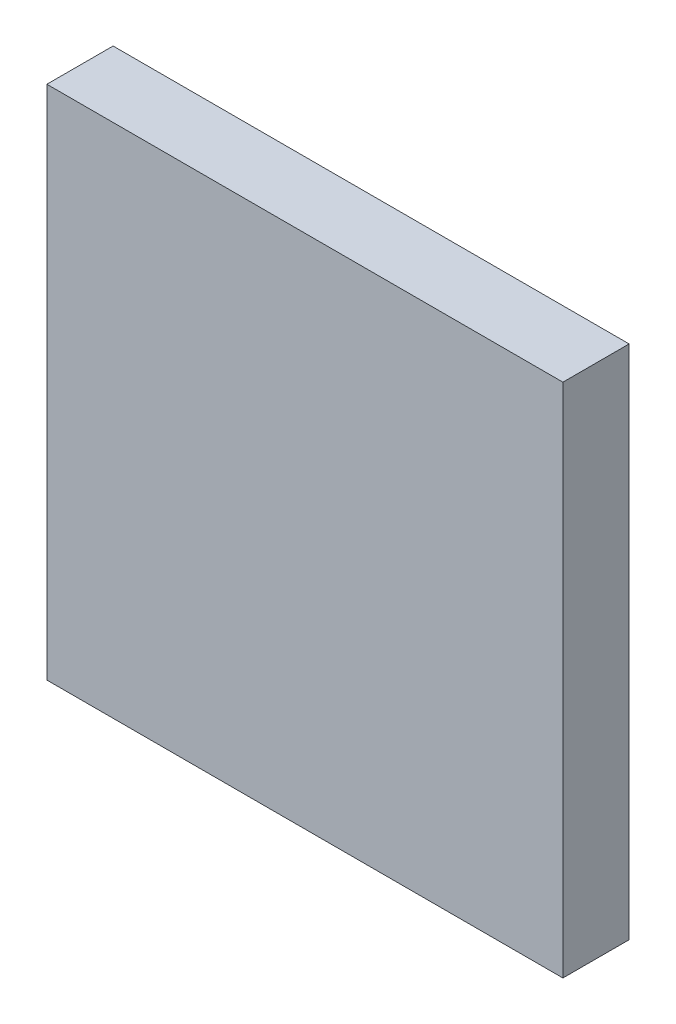
from build123d import *

# Parameters (mm, degrees)
SKETCH_1_W       = 100
SKETCH_1_H       = 100
EXTRUDE_1_DEPTH  = 1.6
SKETCH_4_W       = 17.78
SKETCH_4_H       = 2.5
SKETCH_4_W_2     = 2.5
SKETCH_4_H_2     = 17.78
EXTRUDE_2_DEPTH  = 2.5
SKETCH_5_W       = 0.64
SKETCH_5_H       = 0.64
EXTRUDE_3_DEPTH  = 6.1
SKETCH_6_W       = 3.48
SKETCH_6_H       = 3.48
EXTRUDE_4_DEPTH  = 2
SKETCH_7_W       = 2
SKETCH_7_H       = 4
SKETCH_7_W_2     = 4
SKETCH_7_H_2     = 2
EXTRUDE_5_DEPTH  = 1.1
SKETCH_8_W       = 15.2
SKETCH_8_H       = 7.4
EXTRUDE_6_DEPTH  = 2.65
SKETCH_9_W       = 7.62
SKETCH_9_H       = 2.5
EXTRUDE_7_DEPTH  = 2.5
SKETCH_11_W      = 0.64
SKETCH_11_H      = 0.64
EXTRUDE_8_DEPTH  = 6.1
SKETCH_16_W      = 10.16
SKETCH_16_H      = 2.5
EXTRUDE_12_DEPTH = 2.5
SKETCH_17_W      = 0.64
SKETCH_17_H      = 0.64
EXTRUDE_13_DEPTH = 6.1
EXTRUDE_9_DEPTH  = 6
SKETCH_14_R      = 1
SKETCH_14_W      = 7.62
SKETCH_14_H      = 2.5
SKETCH_14_W_2    = 10.16
EXTRUDE_10_DEPTH = 2
SKETCH_15_W      = 120
SKETCH_15_H      = 120
EXTRUDE_11_DEPTH = 15.4


with BuildPart() as part:
    # ｽｹｯﾁ1 → ﾎﾞｽ - 押し出し1 (new body)
    with BuildSketch(Plane.XY):
        Rectangle(SKETCH_1_W, SKETCH_1_H)
    extrude(amount=EXTRUDE_1_DEPTH)

    # ｽｹｯﾁ4 → ﾎﾞｽ - 押し出し2 (add)
    with BuildSketch(Plane(origin=(0, 0, 0), x_dir=(-1, 0, 0), z_dir=(0, 0, -1))):
        with Locations((20, -42.6)):
            Rectangle(SKETCH_4_W, SKETCH_4_H)
        with Locations((-42.6, -20)):
            Rectangle(SKETCH_4_W_2, SKETCH_4_H_2)
        with Locations((-20, 42.6)):
            Rectangle(SKETCH_4_W, SKETCH_4_H)
        with Locations((42.6, 20)):
            Rectangle(SKETCH_4_W_2, SKETCH_4_H_2)
    extrude(amount=EXTRUDE_2_DEPTH)

    # ｽｹｯﾁ5 → ﾎﾞｽ - 押し出し3 (add)
    with BuildSketch(Plane(origin=(0, 0, -2.5), x_dir=(-1, 0, 0), z_dir=(0, 0, -1))):
        with Locations((-20, 42.6)):
            Rectangle(SKETCH_5_W, SKETCH_5_H)
        with Locations((-17.46, 42.6)):
            Rectangle(SKETCH_5_W, SKETCH_5_H)
        with Locations((-14.92, 42.6)):
            Rectangle(SKETCH_5_W, SKETCH_5_H)
        with Locations((-12.38, 42.6)):
            Rectangle(SKETCH_5_W, SKETCH_5_H)
        with Locations((-22.54, 42.6)):
            Rectangle(SKETCH_5_W, SKETCH_5_H)
        with Locations((-25.08, 42.6)):
            Rectangle(SKETCH_5_W, SKETCH_5_H)
        with Locations((-27.62, 42.6)):
            Rectangle(SKETCH_5_W, SKETCH_5_H)
        with Locations((-42.6, -20)):
            Rectangle(SKETCH_5_W, SKETCH_5_H)
        with Locations((-42.6, -22.54)):
            Rectangle(SKETCH_5_W, SKETCH_5_H)
        with Locations((42.6, 20)):
            Rectangle(SKETCH_5_W, SKETCH_5_H)
        with Locations((-42.6, -25.08)):
            Rectangle(SKETCH_5_W, SKETCH_5_H)
        with Locations((-42.6, -27.62)):
            Rectangle(SKETCH_5_W, SKETCH_5_H)
        with Locations((-42.6, -17.46)):
            Rectangle(SKETCH_5_W, SKETCH_5_H)
        with Locations((-42.6, -14.92)):
            Rectangle(SKETCH_5_W, SKETCH_5_H)
        with Locations((-42.6, -12.38)):
            Rectangle(SKETCH_5_W, SKETCH_5_H)
        with Locations((42.6, 17.46)):
            Rectangle(SKETCH_5_W, SKETCH_5_H)
        with Locations((42.6, 14.92)):
            Rectangle(SKETCH_5_W, SKETCH_5_H)
        with Locations((42.6, 12.38)):
            Rectangle(SKETCH_5_W, SKETCH_5_H)
        with Locations((42.6, 22.54)):
            Rectangle(SKETCH_5_W, SKETCH_5_H)
        with Locations((42.6, 25.08)):
            Rectangle(SKETCH_5_W, SKETCH_5_H)
        with Locations((42.6, 27.62)):
            Rectangle(SKETCH_5_W, SKETCH_5_H)
        with Locations((20, -42.6)):
            Rectangle(SKETCH_5_W, SKETCH_5_H)
        with Locations((17.46, -42.6)):
            Rectangle(SKETCH_5_W, SKETCH_5_H)
        with Locations((14.92, -42.6)):
            Rectangle(SKETCH_5_W, SKETCH_5_H)
        with Locations((12.38, -42.6)):
            Rectangle(SKETCH_5_W, SKETCH_5_H)
        with Locations((22.54, -42.6)):
            Rectangle(SKETCH_5_W, SKETCH_5_H)
        with Locations((25.08, -42.6)):
            Rectangle(SKETCH_5_W, SKETCH_5_H)
        with Locations((27.62, -42.6)):
            Rectangle(SKETCH_5_W, SKETCH_5_H)
    extrude(amount=EXTRUDE_3_DEPTH)

    # ｽｹｯﾁ6 → ﾎﾞｽ - 押し出し4 (add)
    with BuildSketch(Plane.XY.offset(1.6)):
        with Locations((-35, -35)):
            Rectangle(SKETCH_6_W, SKETCH_6_H)
        with Locations((-35, 35)):
            Rectangle(SKETCH_6_W, SKETCH_6_H)
        with Locations((35, -35)):
            Rectangle(SKETCH_6_W, SKETCH_6_H)
        with Locations((35, 35)):
            Rectangle(SKETCH_6_W, SKETCH_6_H)
    extrude(amount=EXTRUDE_4_DEPTH)

    # ｽｹｯﾁ7 → ﾎﾞｽ - 押し出し5 (add)
    with BuildSketch(Plane.XY.offset(1.6)):
        with Locations((-37.5, 0)):
            Rectangle(SKETCH_7_W, SKETCH_7_H)
        with Locations((37.5, 0)):
            Rectangle(SKETCH_7_W, SKETCH_7_H)
        with Locations((0, 37.5)):
            Rectangle(SKETCH_7_W_2, SKETCH_7_H_2)
        with Locations((0, -37.5)):
            Rectangle(SKETCH_7_W_2, SKETCH_7_H_2)
        Rectangle(SKETCH_7_W, SKETCH_7_H)
    extrude(amount=EXTRUDE_5_DEPTH)

    # ｽｹｯﾁ8 → ﾎﾞｽ - 押し出し6 (add)
    with BuildSketch(Plane.XY.offset(1.6)):
        with Locations((0, -17)):
            Rectangle(SKETCH_8_W, SKETCH_8_H)
    extrude(amount=EXTRUDE_6_DEPTH)

    # ｽｹｯﾁ9 → ﾎﾞｽ - 押し出し7 (add)
    with BuildSketch(Plane(origin=(0, 0, 0), x_dir=(-1, 0, 0), z_dir=(0, 0, -1))):
        with Locations((-0.8, 18.58)):
            Rectangle(SKETCH_9_W, SKETCH_9_H)
    extrude(amount=EXTRUDE_7_DEPTH)

    # ｽｹｯﾁ11 → ﾎﾞｽ - 押し出し8 (add)
    with BuildSketch(Plane(origin=(0, 0, -2.5), x_dir=(-1, 0, 0), z_dir=(0, 0, -1))):
        with Locations((-0.8, 18.58)):
            Rectangle(SKETCH_11_W, SKETCH_11_H)
        with Locations((-3.34, 18.58)):
            Rectangle(SKETCH_11_W, SKETCH_11_H)
        with Locations((1.74, 18.58)):
            Rectangle(SKETCH_11_W, SKETCH_11_H)
    extrude(amount=EXTRUDE_8_DEPTH)

    # ｽｹｯﾁ16 → ﾎﾞｽ - 押し出し12 (add)
    with BuildSketch(Plane(origin=(0, 0, 0), x_dir=(-1, 0, 0), z_dir=(0, 0, -1))):
        with Locations((0, -31)):
            Rectangle(SKETCH_16_W, SKETCH_16_H)
    extrude(amount=EXTRUDE_12_DEPTH)

    # ｽｹｯﾁ17 → ﾎﾞｽ - 押し出し13 (add)
    with BuildSketch(Plane(origin=(0, 0, -2.5), x_dir=(-1, 0, 0), z_dir=(0, 0, -1))):
        with Locations((-3.81, -31)):
            Rectangle(SKETCH_17_W, SKETCH_17_H)
        with Locations((-1.27, -31)):
            Rectangle(SKETCH_17_W, SKETCH_17_H)
        with Locations((1.27, -31)):
            Rectangle(SKETCH_17_W, SKETCH_17_H)
        with Locations((3.81, -31)):
            Rectangle(SKETCH_17_W, SKETCH_17_H)
    extrude(amount=EXTRUDE_13_DEPTH)

    # ｽｹｯﾁ13 → ﾎﾞｽ - 押し出し9 (add)
    with BuildSketch(Plane(origin=(0, 0, 0), x_dir=(-1, 0, 0), z_dir=(0, 0, -1))):
        Polygon((32, -30), (31, -28.267949192), (29, -28.267949192), (28, -30), (29, -31.732050808), (31, -31.732050808), align=None)
        Polygon((-28, -30), (-29, -28.267949192), (-31, -28.267949192), (-32, -30), (-31, -31.732050808), (-29, -31.732050808), align=None)
        Polygon((32, 30), (31, 31.732050808), (29, 31.732050808), (28, 30), (29, 28.267949192), (31, 28.267949192), align=None)
        Polygon((-28, 30), (-29, 31.732050808), (-31, 31.732050808), (-32, 30), (-31, 28.267949192), (-29, 28.267949192), align=None)
    extrude(amount=EXTRUDE_9_DEPTH)


with BuildPart() as body_2:
    # ｽｹｯﾁ14 → ﾎﾞｽ - 押し出し10 (new body)
    with BuildSketch(Plane(origin=(0, 0, -6), x_dir=(-1, 0, 0), z_dir=(0, 0, -1))):
        Polygon((0, -39), (0, -41), (39, -41), (39, 0), (41, 0), (41, 39), (0, 39), (0, 41), (-39, 41), (-39, 0), (-41, 0), (-41, -39), align=None)
        with Locations((-30, 30)):
            Circle(SKETCH_14_R, mode=Mode.SUBTRACT)
        with Locations((30, 30)):
            Circle(SKETCH_14_R, mode=Mode.SUBTRACT)
        with Locations((30, -30)):
            Circle(SKETCH_14_R, mode=Mode.SUBTRACT)
        with Locations((-30, -30)):
            Circle(SKETCH_14_R, mode=Mode.SUBTRACT)
        with Locations((-0.8, 18.58)):
            Rectangle(SKETCH_14_W, SKETCH_14_H, mode=Mode.SUBTRACT)
        with Locations((0, -31)):
            Rectangle(SKETCH_14_W_2, SKETCH_14_H, mode=Mode.SUBTRACT)
    extrude(amount=EXTRUDE_10_DEPTH)


with BuildPart() as body_3:
    # ｽｹｯﾁ15 → ﾎﾞｽ - 押し出し11 (new body)
    with BuildSketch(Plane(origin=(0, 0, -2.5), x_dir=(-1, 0, 0), z_dir=(0, 0, -1))):
        Rectangle(SKETCH_15_W, SKETCH_15_H)
    extrude(amount=-EXTRUDE_11_DEPTH)


solid = Compound([part.part, body_2.part, body_3.part])
